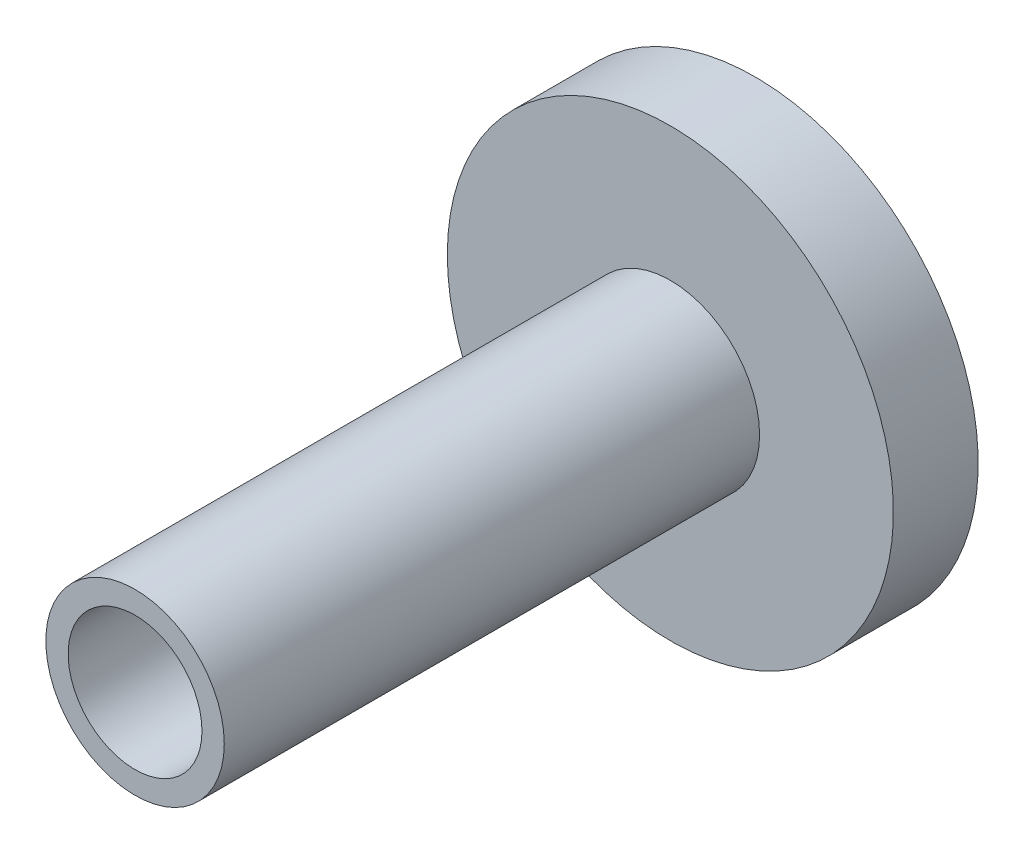
from build123d import *

# Parameters (mm, degrees)
SKETCH_1_R          = 5
EXTRUDE_1_DEPTH     = 1.9
SKETCH_2_R          = 2
EXTRUDE_2_DEPTH     = 12
SKETCH_3_R          = 1.5
CUT_EXTRUDE_1_DEPTH = 12


with BuildPart() as part:
    # 草图1 → 凸台-拉伸1 (new body)
    with BuildSketch(Plane.XY):
        with Locations(Location((0, 0, 0), (0, 0, 180))):
            Circle(SKETCH_1_R)
    extrude(amount=EXTRUDE_1_DEPTH)

    # 草图2 → 凸台-拉伸2 (add)
    with BuildSketch(Plane.XY.offset(1.9)):
        Circle(SKETCH_2_R)
    extrude(amount=EXTRUDE_2_DEPTH)

    # 草图3 → 切除-拉伸1 (cut)
    with BuildSketch(Plane.XY.offset(13.9)):
        Circle(SKETCH_3_R)
    extrude(amount=-CUT_EXTRUDE_1_DEPTH, mode=Mode.SUBTRACT)


solid = part.part
